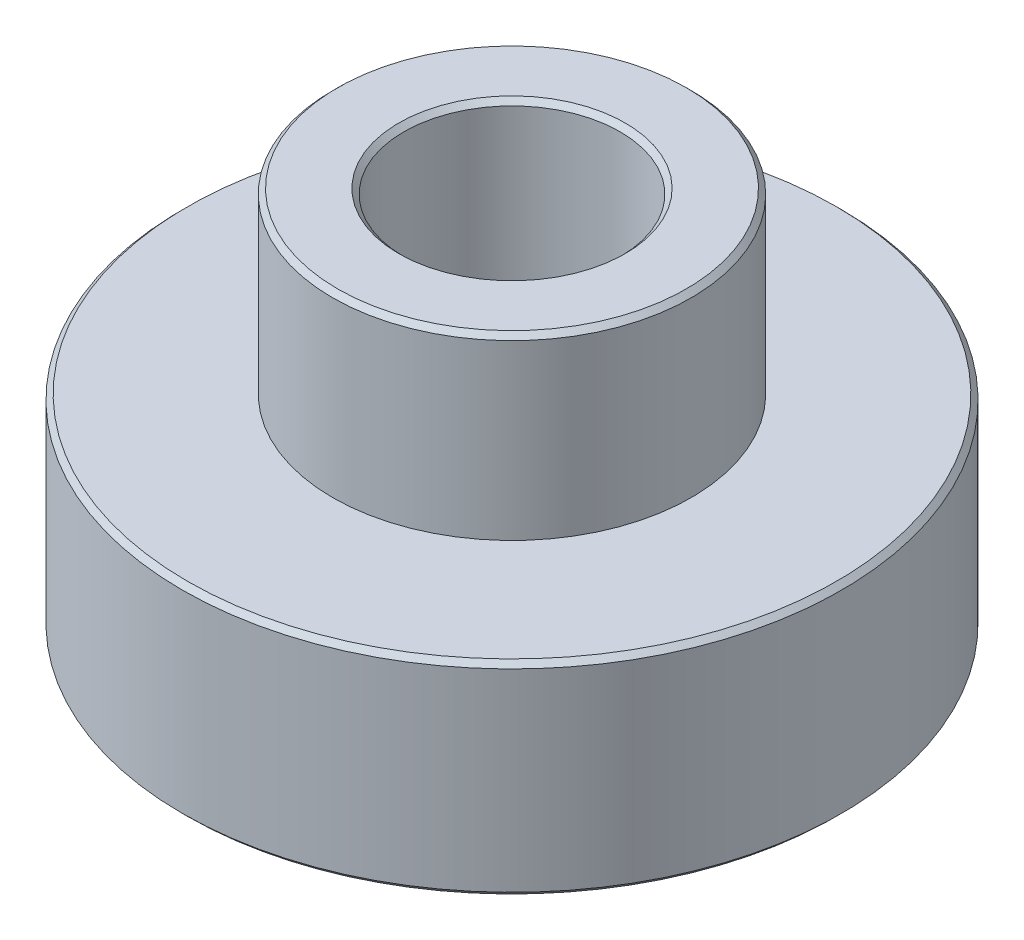
from build123d import *

# Parameters (mm, degrees)
SKETCH_1_R          = 12.95
EXTRUDE_1_DEPTH     = 8
SKETCH_2_R          = 7.05
EXTRUDE_2_DEPTH     = 7
SKETCH_3_R          = 4.25
CUT_EXTRUDE_1_DEPTH = 24.672874773
CHAMFER_1_SIZE      = 0.2


with BuildPart() as part:
    # 草图1 → 凸台-拉伸1 (new body)
    with BuildSketch(Plane(origin=(0, 0, 0), x_dir=(1, 0, 0), z_dir=(0, 1, 0))):
        with Locations(Location((0, 0, 0), (0, 0, 270))):
            Circle(SKETCH_1_R)
    extrude(amount=EXTRUDE_1_DEPTH)

    # 草图2 → 凸台-拉伸2 (add)
    with BuildSketch(Plane(origin=(0, 8, 0), x_dir=(1, 0, 0), z_dir=(0, 1, 0))):
        with Locations(Location((0, 0, 0), (0, 0, 270))):
            Circle(SKETCH_2_R)
    extrude(amount=EXTRUDE_2_DEPTH)

    # 草图3 → 切除-拉伸1 (cut, through all)
    with BuildSketch(Plane.XZ):
        with Locations(Location((0, 0, 0), (0, 0, 270))):
            Circle(SKETCH_3_R)
    extrude(amount=-CUT_EXTRUDE_1_DEPTH, mode=Mode.SUBTRACT)

    # 倒角1
    chamfer_1_edges = [part.edges().sort_by_distance(p)[0] for p in [
        (0, 15, 4.25),
        (0, 0, 4.25),
        (0, 0, -12.95),
        (0, 8, -12.95),
        (0, 15, -7.05),
    ]]
    chamfer(chamfer_1_edges, length=CHAMFER_1_SIZE)


solid = part.part
